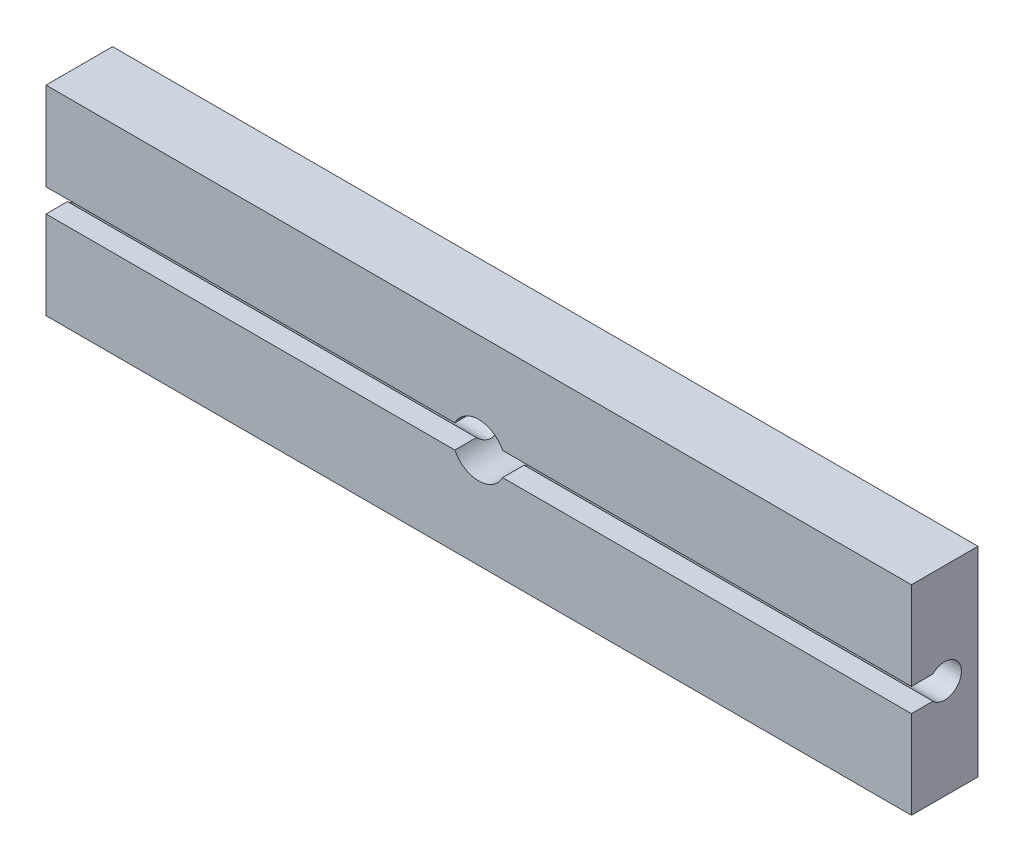
from build123d import *

# Parameters (mm, degrees)
SKETCH_1_R           = 4
SKETCH_1_R_2         = 15
EXTRUDE_2_DEPTH      = 10
SKETCH_2_W           = 48
SKETCH_2_H           = 4
CUT_EXTRUDE_3_DEPTH  = 68.453687816
CUT_EXTRUDE_4_DEPTH  = 68.453687816
SKETCH_4_W           = 48
SKETCH_4_H           = 4
EXTRUDE_3_DEPTH      = 10
SKETCH_5_W           = 10
SKETCH_5_H           = 4
EXTRUDE_4_DEPTH      = 100
SKETCH_6_W           = 15
SKETCH_6_H           = 10
CUT_EXTRUDE_5_DEPTH  = 100
SKETCH_7_R           = 2.5
CUT_EXTRUDE_14_DEPTH = 117.404467268
SKETCH_11_R          = 4
CUT_EXTRUDE_15_DEPTH = 68.45368795
SKETCH_12_R          = 15
EXTRUDE_5_DEPTH      = 10
SKETCH_14_W          = 100
SKETCH_14_H          = 10
EXTRUDE_6_DEPTH      = 30
SKETCH_15_R          = 2.5
CUT_EXTRUDE_16_DEPTH = 117.40446729
SKETCH_16_R          = 4
CUT_EXTRUDE_17_DEPTH = 68.45368795
SKETCH_17_W          = 15
SKETCH_17_H          = 30
EXTRUDE_7_DEPTH      = 10
SKETCH_18_R          = 2.5
CUT_EXTRUDE_18_DEPTH = 132.244047492
CUT_EXTRUDE_19_DEPTH = 132.244047591


with BuildPart() as part:
    # 草图1 → 凸台-拉伸2 (new body)
    # profile 1 of 3: a face of its own
    with BuildSketch(Plane.XY):
        with BuildLine():
            Line((50.00000004, 15), (-50, 15))
            ThreePointArc((-50, 15), (-39.393398282, 10.606601718), (-35, 0))
            ThreePointArc((-35, 0), (-39.393398282, -10.606601718), (-50, -15))
            Line((-50, -15), (50, -15))
            ThreePointArc((50, -15), (35, 2e-08), (50.00000004, 15))
        make_face()
        Circle(SKETCH_1_R, mode=Mode.SUBTRACT)
    # profile 2 of 3: a face of its own
    with BuildSketch(Plane.XY):
        with Locations((-50, 0)):
            Circle(SKETCH_1_R_2)
    # profile 3 of 3: a face of its own
    with BuildSketch(Plane.XY):
        with Locations((50, 0)):
            Circle(SKETCH_1_R_2)
    extrude(amount=EXTRUDE_2_DEPTH)

    # 草图2 → 切除-拉伸3 (cut, through all)
    with BuildSketch(Plane.XY.offset(10)):
        with Locations((26, 10)):
            Rectangle(SKETCH_2_W, SKETCH_2_H)
        with Locations((-26, 10)):
            Rectangle(SKETCH_2_W, SKETCH_2_H)
        with Locations((-26, -10)):
            Rectangle(SKETCH_2_W, SKETCH_2_H)
        with Locations((26, -10)):
            Rectangle(SKETCH_2_W, SKETCH_2_H)
    extrude(amount=-CUT_EXTRUDE_3_DEPTH, mode=Mode.SUBTRACT)

    # 草图3 → 切除-拉伸4 (cut, through all)
    with BuildSketch(Plane.XY.offset(10)):
        with BuildLine():
            Line((-3.464101615, 2), (-50, 2))
            Line((-50, 2), (-50, 0))
            Line((-50, 0), (-4, 0))
            ThreePointArc((-4, 0), (-3.863703305, 1.03527618), (-3.464101615, 2))
        make_face()
        with BuildLine():
            Line((-4, 0), (-50, 0))
            Line((-50, 0), (-50, -2))
            Line((-50, -2), (-3.464101615, -2))
            ThreePointArc((-3.464101615, -2), (-3.863703305, -1.03527618), (-4, 0))
        make_face()
        with BuildLine():
            Line((50, 0), (4, 0))
            ThreePointArc((4, 0), (3.863703305, -1.03527618), (3.464101615, -2))
            Line((3.464101615, -2), (50, -2))
            Line((50, -2), (50, 0))
        make_face()
        with BuildLine():
            Line((50, 2), (3.464101615, 2))
            ThreePointArc((3.464101615, 2), (3.863703305, 1.03527618), (4, 0))
            Line((4, 0), (50, 0))
            Line((50, 0), (50, 2))
        make_face()
    extrude(amount=-CUT_EXTRUDE_4_DEPTH, mode=Mode.SUBTRACT)

    # 草图4 → 凸台-拉伸3 (add)
    with BuildSketch(Plane.XY.offset(10)):
        with Locations((26, 10)):
            Rectangle(SKETCH_4_W, SKETCH_4_H)
        with Locations((26, -10)):
            Rectangle(SKETCH_4_W, SKETCH_4_H)
        with Locations((-26, 10)):
            Rectangle(SKETCH_4_W, SKETCH_4_H)
        with Locations((-26, -10)):
            Rectangle(SKETCH_4_W, SKETCH_4_H)
    extrude(amount=-EXTRUDE_3_DEPTH)

    # 草图5 → 凸台-拉伸4 (add)
    with BuildSketch(Plane(origin=(-50, 0, 0), x_dir=(0, 0, -1), z_dir=(1, 0, 0))):
        with Locations((-5, 0)):
            Rectangle(SKETCH_5_W, SKETCH_5_H)
    extrude(amount=EXTRUDE_4_DEPTH)

    # 草图6 → 切除-拉伸5 (cut)
    with BuildSketch(Plane.XZ.offset(15)):
        with Locations((-57.5, 5)):
            Rectangle(SKETCH_6_W, SKETCH_6_H)
    extrude(amount=-CUT_EXTRUDE_5_DEPTH, mode=Mode.SUBTRACT)

    # 草图7 → 切除-拉伸14 (cut, through all)
    with BuildSketch(Plane.ZY.offset(50)):
        with Locations((5, 0)):
            Circle(SKETCH_7_R)
    extrude(amount=-CUT_EXTRUDE_14_DEPTH, mode=Mode.SUBTRACT)

    # 草图11 → 切除-拉伸15 (cut, through all)
    with BuildSketch(Plane.XY.offset(10)):
        Circle(SKETCH_11_R)
    extrude(amount=-CUT_EXTRUDE_15_DEPTH, mode=Mode.SUBTRACT)

    # 草图12 → 凸台-拉伸5 (add)
    with BuildSketch(Plane.XY.offset(10)):
        with Locations((-50, 0)):
            Circle(SKETCH_12_R)
    extrude(amount=-EXTRUDE_5_DEPTH)

    # 草图14 → 凸台-拉伸6 (add)
    with BuildSketch(Plane(origin=(0, 15, 0), x_dir=(1, 0, 0), z_dir=(0, 1, 0))):
        with Locations((0, -5)):
            Rectangle(SKETCH_14_W, SKETCH_14_H)
    extrude(amount=-EXTRUDE_6_DEPTH)

    # 草图15 → 切除-拉伸16 (cut, through all)
    with BuildSketch(Plane(origin=(50, 0, 0), x_dir=(0, 0, -1), z_dir=(1, 0, 0))):
        with Locations(Location((-5, 0, 0), (0, 0, 180))):
            Circle(SKETCH_15_R)
    extrude(amount=-CUT_EXTRUDE_16_DEPTH, mode=Mode.SUBTRACT)

    # 草图16 → 切除-拉伸17 (cut, through all)
    with BuildSketch(Plane.XY.offset(10)):
        Circle(SKETCH_16_R)
    extrude(amount=-CUT_EXTRUDE_17_DEPTH, mode=Mode.SUBTRACT)

    # 草图17 → 凸台-拉伸7 (add)
    with BuildSketch(Plane.XY.offset(10)):
        with Locations((57.5, 0)):
            Rectangle(SKETCH_17_W, SKETCH_17_H)
        with Locations((-57.5, 0)):
            Rectangle(SKETCH_17_W, SKETCH_17_H)
    extrude(amount=-EXTRUDE_7_DEPTH)

    # 草图18 → 切除-拉伸18 (cut, through all)
    with BuildSketch(Plane.ZY.offset(65)):
        with Locations((5, 0)):
            Circle(SKETCH_18_R)
    extrude(amount=-CUT_EXTRUDE_18_DEPTH, mode=Mode.SUBTRACT)

    # 草图19 → 切除-拉伸19 (cut, through all)
    with BuildSketch(Plane.ZY.offset(65)):
        with BuildLine():
            Line((10, 1.767766953), (6.767766953, 1.767766953))
            ThreePointArc((6.767766953, 1.767766953), (7.309698831, 0.956708581), (7.5, 0))
            ThreePointArc((7.5, 0), (7.309698831, -0.956708581), (6.767766953, -1.767766953))
            Line((6.767766953, -1.767766953), (10, -1.767766953))
            Line((10, -1.767766953), (10, 1.767766953))
        make_face()
    extrude(amount=-CUT_EXTRUDE_19_DEPTH, mode=Mode.SUBTRACT)


solid = part.part
